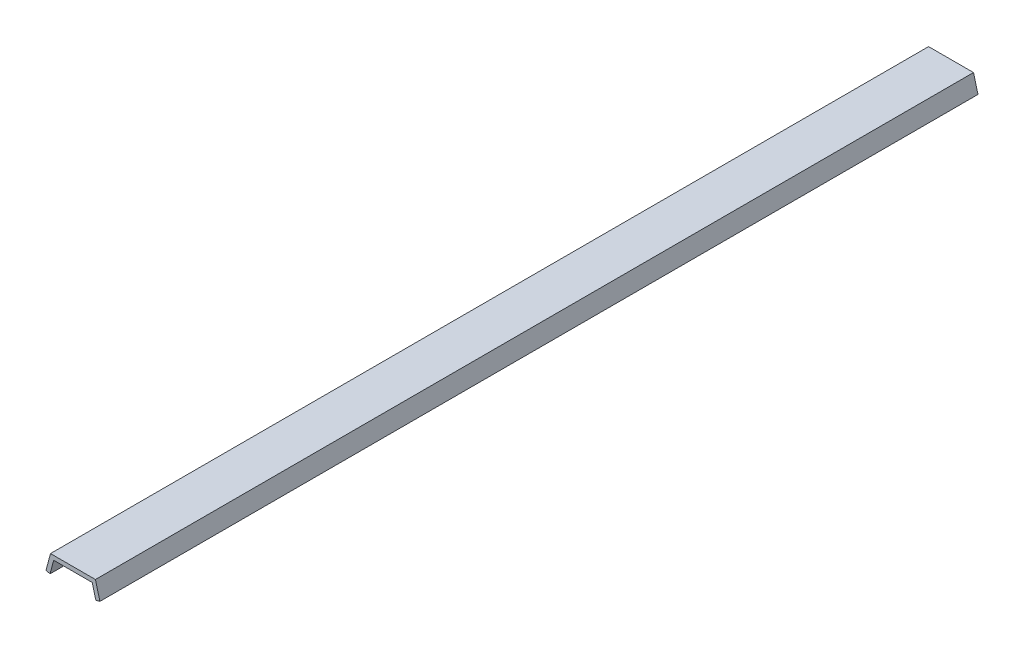
from build123d import *

# Parameters (mm, degrees)
EXTRUDE_THIN1_DEPTH = 105


with BuildPart() as part:
    # Sketch2 → Extrude-Thin1 (new, symmetric)
    with BuildSketch(Plane.XY):
        Polygon((6.44679677, 0), (5.375, 4), (-5.375, 4), (-6.44679677, 0), (-5.480870943, -0.258819045), (-4.607673012, 3), (4.607673012, 3), (5.480870943, -0.258819045), align=None)
    extrude(amount=EXTRUDE_THIN1_DEPTH, both=True)


solid = part.part
